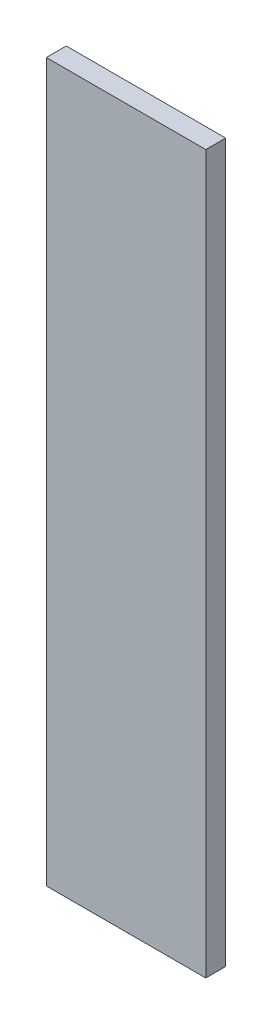
from build123d import *

# Parameters (mm, degrees)
SKETCH1_W           = 80
SKETCH1_H           = 360
BOSS_EXTRUDE1_DEPTH = 10


with BuildPart() as part:
    # Sketch1 → Boss-Extrude1 (new body)
    with BuildSketch(Plane.XY):
        Rectangle(SKETCH1_W, SKETCH1_H)
    extrude(amount=BOSS_EXTRUDE1_DEPTH)


solid = part.part
